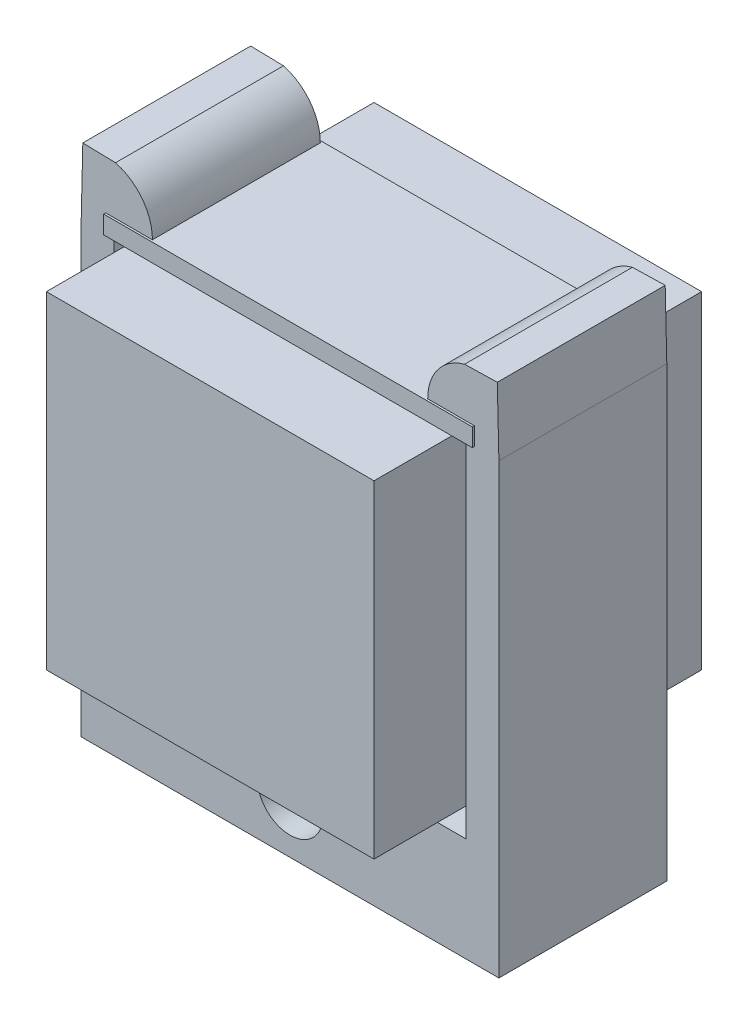
from build123d import *

# Parameters (mm, degrees)
SKETCH1_W                            = 45
SKETCH1_H                            = 21
BOSS_EXTRUDE1_DEPTH                  = 2.2
SKETCH2_W                            = 40
SKETCH2_H                            = 40
BOSS_EXTRUDE2_DEPTH                  = 40
SKETCH3_W                            = 43
SKETCH3_H                            = 12.7
SKETCH3_R                            = 4
SNAPFIT_43MM_SPACING_5MM_WIDTH_DEPTH = 10.25


with BuildPart() as part:
    # Sketch1 → Boss-Extrude1 (new body)
    with BuildSketch(Plane(origin=(0, 0, 0), x_dir=(1, 0, 0), z_dir=(0, 1, 0))):
        Rectangle(SKETCH1_W, SKETCH1_H)
    extrude(amount=BOSS_EXTRUDE1_DEPTH)


with BuildPart() as body_2:
    # Sketch2 → Boss-Extrude2 (new body)
    with BuildSketch(Plane(origin=(0, 0, 0), x_dir=(1, 0, 0), z_dir=(0, 1, 0))):
        Rectangle(SKETCH2_W, SKETCH2_H)
    extrude(amount=-BOSS_EXTRUDE2_DEPTH)


with BuildPart() as body_3:
    # Sketch3 → SnapFit-43mm_spacing-5mm_width (new, symmetric)
    # profile 1 of 3: a face of its own
    with BuildSketch(Plane.XY):
        with Locations((0, -48.35)):
            Rectangle(SKETCH3_W, SKETCH3_H)
        with Locations((0, -48.35)):
            Circle(SKETCH3_R, mode=Mode.SUBTRACT)
    # profile 2 of 3: a face of its own
    with BuildSketch(Plane.XY):
        with BuildLine():
            Line((-25.5, -54.7), (-21.5, -54.7))
            Line((-21.5, -54.7), (-21.5, -42))
            Line((-21.5, -42), (-21.5, 0))
            Line((-21.5, 0), (-21.447633889, 2.199376682))
            Line((-21.447633889, 2.199376682), (-16.805950526, 2.088860412))
            ThreePointArc((-16.805950526, 2.088860412), (-18.015587607, 5.874169911), (-21.305950526, 8.102465613))
            Line((-21.305950526, 8.102465613), (-25.304817221, 8.197676725))
            Line((-25.304817221, 8.197676725), (-25.5, 0))
            Line((-25.5, 0), (-25.5, -54.7))
        make_face()
    # profile 3 of 3: a face of its own
    with BuildSketch(Plane.XY):
        with BuildLine():
            Line((21.5, -42), (21.5, -54.7))
            Line((21.5, -54.7), (25.5, -54.7))
            Line((25.5, -54.7), (25.5, 0))
            Line((25.5, 0), (25.304817221, 8.197676725))
            Line((25.304817221, 8.197676725), (21.305950526, 8.102465613))
            ThreePointArc((21.305950526, 8.102465613), (18.015587607, 5.874169911), (16.805950526, 2.088860412))
            Line((16.805950526, 2.088860412), (21.447633889, 2.199376682))
            Line((21.447633889, 2.199376682), (21.5, 0))
            Line((21.5, 0), (21.5, -42))
        make_face()
    extrude(amount=SNAPFIT_43MM_SPACING_5MM_WIDTH_DEPTH, both=True)


solid = Compound([part.part, body_2.part, body_3.part])
